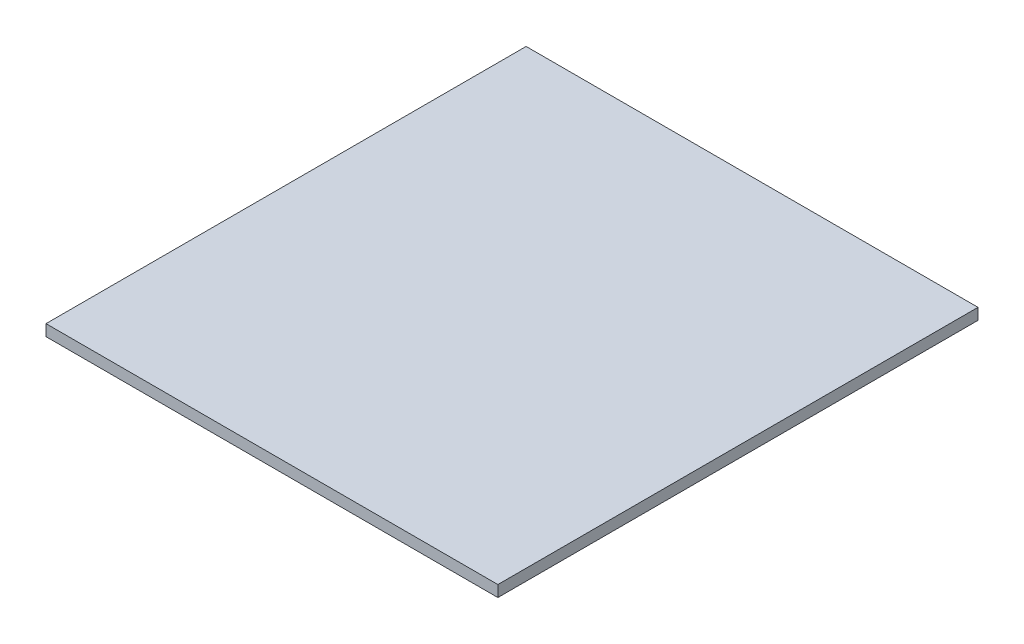
from build123d import *

# Parameters (mm, degrees)
SKETCH1_W           = 160
SKETCH1_H           = 170
BOSS_EXTRUDE1_DEPTH = 4


with BuildPart() as part:
    # Sketch1 → Boss-Extrude1 (new body)
    with BuildSketch(Plane(origin=(0, 0, 0), x_dir=(1, 0, 0), z_dir=(0, 1, 0))):
        with Locations((0, 32.361278986)):
            Rectangle(SKETCH1_W, SKETCH1_H)
    extrude(amount=BOSS_EXTRUDE1_DEPTH)


solid = part.part
